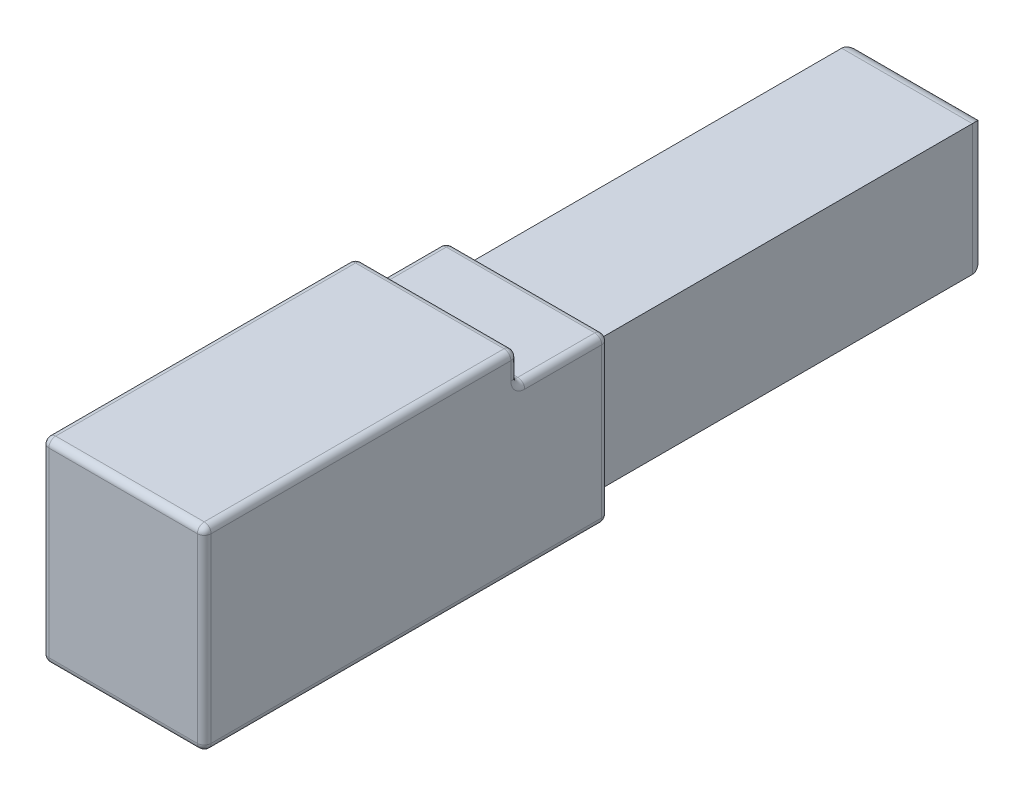
from build123d import *

# Parameters (mm, degrees)
BOSS_EXTRUDE1_DEPTH = 14.986
SKETCH2_W           = 12.065
SKETCH2_H           = 12.065
BOSS_EXTRUDE2_DEPTH = 36.322
FILLET1_R           = 1.27
FILLET2_R           = 0.635
SKETCH3_R           = 4.445
CUT_EXTRUDE1_DEPTH  = 31.75


with BuildPart() as part:
    # Sketch1 → Boss-Extrude1 (new body)
    with BuildSketch(Plane(origin=(0, 0, 0), x_dir=(0, 0, -1), z_dir=(1, 0, 0))):
        Polygon((0, 0), (0, 18.034), (28.956, 18.034), (28.956, 15.113), (37.338, 15.113), (37.338, 0), align=None)
    extrude(amount=BOSS_EXTRUDE1_DEPTH)

    # Sketch2 → Boss-Extrude2 (add)
    with BuildSketch(Plane(origin=(0, 0, -37.338), x_dir=(-1, 0, 0), z_dir=(0, 0, -1))):
        with Locations((-7.493, 7.5565)):
            Rectangle(SKETCH2_W, SKETCH2_H)
    extrude(amount=BOSS_EXTRUDE2_DEPTH)

    # Fillet1
    fillet1_edges = [part.edges().sort_by_distance(p)[0] for p in [
        (1.4605, 7.5565, -73.66),
        (7.493, 13.589, -73.66),
        (13.5255, 7.5565, -73.66),
        (7.493, 1.524, -73.66),
    ]]
    fillet(fillet1_edges, radius=FILLET1_R)

    # Fillet2
    fillet2_edges = [part.edges().sort_by_distance(p)[0] for p in [
        (14.986, 15.113, -33.147),
        (7.493, 0, 0),
        (7.493, 18.034, 0),
        (7.493, 18.034, -28.956),
        (7.493, 15.113, -28.956),
        (7.493, 15.113, -37.338),
        (7.493, 0, -37.338),
        (14.986, 16.5735, -28.956),
        (14.986, 18.034, -14.478),
        (14.986, 9.017, 0),
        (14.986, 0, -18.669),
        (0, 9.017, 0),
        (0, 18.034, -14.478),
        (0, 16.5735, -28.956),
        (14.986, 7.5565, -37.338),
        (0, 15.113, -33.147),
        (0, 7.5565, -37.338),
        (0, 0, -18.669),
    ]]
    fillet(fillet2_edges, radius=FILLET2_R)

    # Sketch3 → Cut-Extrude1 (cut)
    with BuildSketch(Plane(origin=(0, 0, -73.66), x_dir=(-1, 0, 0), z_dir=(0, 0, -1))):
        with Locations((-7.493, 7.5565)):
            Circle(SKETCH3_R)
    extrude(amount=-CUT_EXTRUDE1_DEPTH, mode=Mode.SUBTRACT)


solid = part.part
